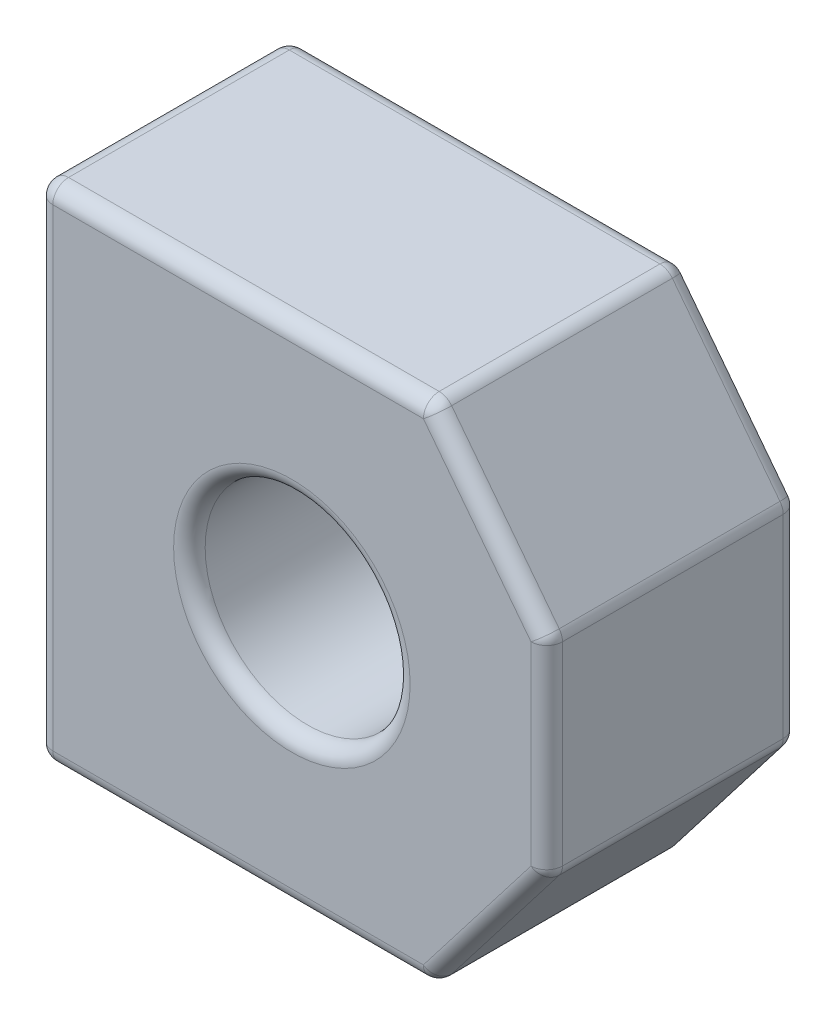
from build123d import *

# Parameters (mm, degrees)
BOSS_EXTRUDE1_DEPTH = 16
SKETCH4_R           = 6.5
CUT_EXTRUDE1_DEPTH  = 11
SKETCH5_R           = 3.45
CUT_EXTRUDE2_DEPTH  = 11
FILLET1_R           = 1


with BuildPart() as part:
    # Sketch3 → Boss-Extrude1 (new body)
    with BuildSketch(Plane.XY):
        Polygon((0, 0), (0, -32), (25, -32), (32.331439149, -22.5), (32.331439149, -9.5), (25, 0), align=None)
    extrude(amount=BOSS_EXTRUDE1_DEPTH)

    # Sketch4 → Cut-Extrude1 (cut)
    with BuildSketch(Plane.XY.offset(16)):
        with Locations((16.165719575, -16)):
            Circle(SKETCH4_R)
    extrude(amount=-CUT_EXTRUDE1_DEPTH, mode=Mode.SUBTRACT)

    # Sketch5 → Cut-Extrude2 (cut)
    with BuildSketch(Plane.XY.offset(5)):
        with Locations((16.165719575, -16)):
            Circle(SKETCH5_R)
    extrude(amount=-CUT_EXTRUDE2_DEPTH, mode=Mode.SUBTRACT)

    # Fillet1
    fillet1_edges = [part.edges().sort_by_distance(p)[0] for p in [
        (25, 0, 8),
        (32.331439149, -9.5, 8),
        (32.331439149, -22.5, 8),
        (25, -32, 8),
        (0, -32, 8),
        (0, 0, 8),
        (12.5, -32, 16),
        (28.665719575, -27.25, 16),
        (32.331439149, -16, 16),
        (9.665719575, -16, 5),
        (9.665719575, -16, 16),
        (28.665719575, -4.75, 16),
        (12.5, 0, 16),
        (28.665719575, -4.75, 0),
        (32.331439149, -16, 0),
        (28.665719575, -27.25, 0),
        (12.5, -32, 0),
        (0, -16, 0),
        (12.5, 0, 0),
        (0, -16, 16),
    ]]
    fillet(fillet1_edges, radius=FILLET1_R)


solid = part.part
